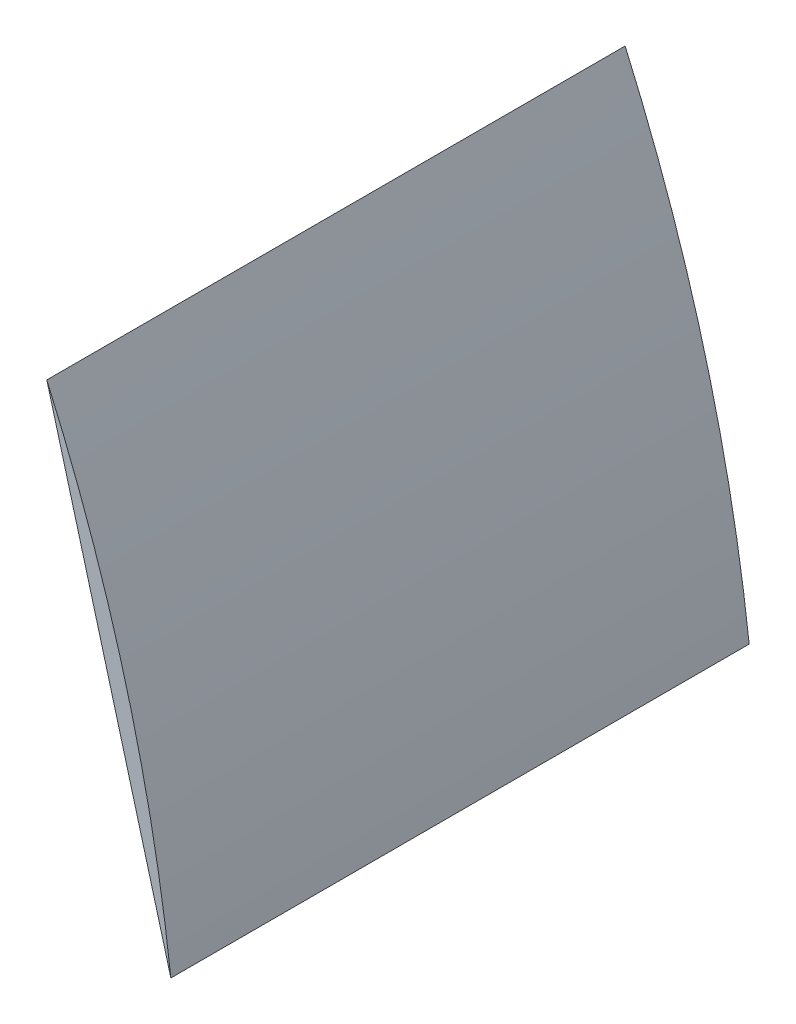
from build123d import *

# Parameters (mm, degrees)
CURVEBOSS_DEPTH = 7.139


with BuildPart() as part:
    # CurveSketch → CurveBoss (new body)
    with BuildSketch(Plane.XY):
        with BuildLine():
            Line((14.458485626, 16.02752855), (12.927307673, 21.655822369))
            ThreePointArc((12.927307673, 21.655822369), (13.902023889, 18.898568548), (14.458485626, 16.02752855))
        make_face()
    extrude(amount=CURVEBOSS_DEPTH)


solid = part.part
